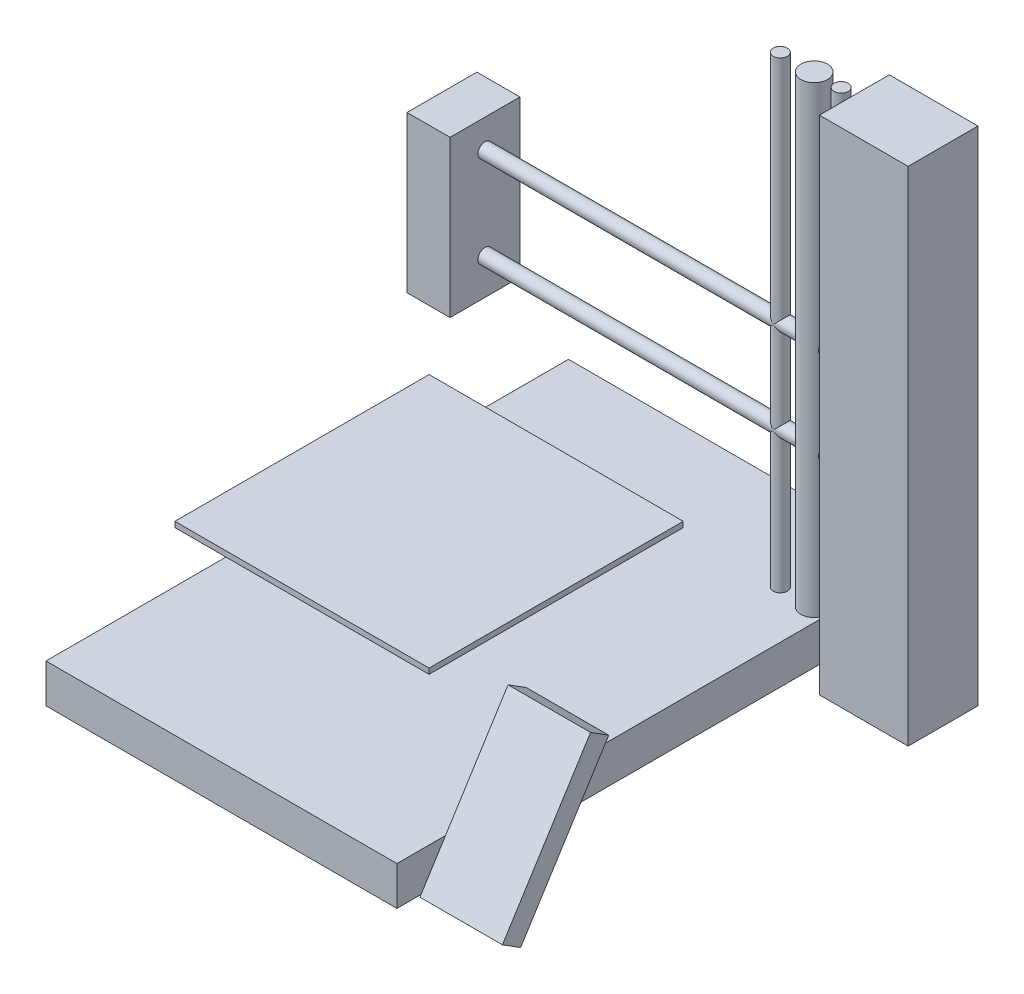
from build123d import *

# Parameters (mm, degrees)
BOSS_EXTRUDE2_DEPTH      = 185
BOSS_EXTRUDE2_DEPTH_BACK = 185
SKETCH4_W                = 248.533663501
SKETCH4_H                = 27.532163485
SKETCH5_W                = 180
SKETCH5_H                = 3.871635079
BOSS_EXTRUDE3_DEPTH      = 90
BOSS_EXTRUDE4_DEPTH      = 177.8
BOSS_EXTRUDE4_DEPTH_BACK = 177.8
SKETCH6_R                = 5.025331162
SKETCH6_R_2              = 9.441458003
SKETCH6_W                = 62.792760194
SKETCH6_H                = 49.48497721
SKETCH7_R                = 5.025331162
SKETCH7_R_2              = 5.072702707
BOSS_EXTRUDE5_DEPTH      = 292.1
SKETCH8_W                = 49.48497721
SKETCH8_H                = 110.589366722
BOSS_EXTRUDE6_DEPTH      = 30.48
BOSS_EXTRUDE7_DEPTH      = 63.5
SKETCH10_W               = 127.680202502
SKETCH10_H               = 144.797768112
CUT_EXTRUDE1_DEPTH       = 5.08


with BuildPart() as part:
    # Sketch4 → Boss-Extrude2 (new, two sides: drawn at the far end of the back side and taken through both)
    with BuildSketch(Plane.XY.offset(-BOSS_EXTRUDE2_DEPTH_BACK)):
        with Locations((-40.733168249, -164.033918258)):
            Rectangle(SKETCH4_W, SKETCH4_H)
    extrude(amount=BOSS_EXTRUDE2_DEPTH + BOSS_EXTRUDE2_DEPTH_BACK)

    # Sketch6 → Boss-Extrude4 (add, two sides: drawn at the far end of the back side and taken through both)
    with BuildSketch(Plane(origin=(0, 0, 0), x_dir=(1, 0, 0), z_dir=(0, 1, 0)).offset(-BOSS_EXTRUDE4_DEPTH_BACK)):
        with Locations(Location((92.850962378, 120.294813631, 0), (0, 0, 270))):
            Circle(SKETCH6_R)
        with Locations(Location((49.741152746, 120.294813631, 0), (0, 0, 270))):
            Circle(SKETCH6_R)
        with Locations(Location((73.714412737, 120.294813631, 0), (0, 0, 270))):
            Circle(SKETCH6_R_2)
        with Locations((133.603619903, 120.294813631)):
            Rectangle(SKETCH6_W, SKETCH6_H)
    extrude(amount=BOSS_EXTRUDE4_DEPTH + BOSS_EXTRUDE4_DEPTH_BACK)


with BuildPart() as body_2:
    # Sketch5 → Boss-Extrude3 (new, symmetric)
    with BuildSketch(Plane.XY):
        with Locations((-78.709697899, -115.907075187)):
            Rectangle(SKETCH5_W, SKETCH5_H)
    extrude(amount=BOSS_EXTRUDE3_DEPTH, both=True)


with BuildPart() as boss_extrude4_piece_1:
    # of the separate pieces the step leaves, piece 1, a body of its own (boss_extrude4_pieces)
    add(part.part.solids().sort_by_distance((-165, -150.267836515, 185))[0])



with BuildPart() as boss_extrude4_piece_2:
    # of the separate pieces the step leaves, piece 2, a body of its own (boss_extrude4_pieces)
    add(part.part.solids().sort_by_distance((165, 177.8, -145.037302236))[0])


with BuildPart() as boss_extrude4_piece_3:
    # of the separate pieces the step leaves, piece 3, a body of its own (boss_extrude4_pieces)
    add(part.part.solids().sort_by_distance((92.850962378, 0, -115.269482469))[0])


with BuildPart() as boss_extrude4_piece_1_1:
    add(boss_extrude4_piece_1.part)

    add(boss_extrude4_piece_2.part)  # Boss-Extrude5 merges Boss-Extrude4 piece 2

    add(boss_extrude4_piece_3.part)  # Boss-Extrude5 merges Boss-Extrude4 piece 3
    # Sketch7 → Boss-Extrude5 (add)
    with BuildSketch(Plane.ZY.offset(-102.207239806)):
        with Locations(Location((-120.294813631, 13.308745585, 0), (0, 0, 180))):
            Circle(SKETCH7_R)
        with Locations(Location((-120.294813631, -51.589208853, 0), (0, 0, 180))):
            Circle(SKETCH7_R_2)
    extrude(amount=BOSS_EXTRUDE5_DEPTH)

    # Sketch8 → Boss-Extrude6 (add)
    with BuildSketch(Plane.ZY.offset(189.892760194)):
        with Locations((-120.294813631, -21.884996612)):
            Rectangle(SKETCH8_W, SKETCH8_H)
    extrude(amount=-BOSS_EXTRUDE6_DEPTH)


with BuildPart() as body_3:
    # Sketch9 → Boss-Extrude7 (new body)
    with BuildSketch(Plane(origin=(88.9, 0, 0), x_dir=(0, 0, -1), z_dir=(1, 0, 0))):
        Polygon((-103.861334795, -77.657367924), (-166.284847112, -176.717367924), (-179.17835943, -168.592410071), (-116.754847112, -69.532410071), align=None)
    extrude(amount=BOSS_EXTRUDE7_DEPTH)

    # Sketch10 → Cut-Extrude1 (cut)
    with BuildSketch(Plane.ZY.offset(-88.9)):
        with Locations((163.77033748, -106.804637192)):
            Rectangle(SKETCH10_W, SKETCH10_H)
    extrude(amount=-CUT_EXTRUDE1_DEPTH, mode=Mode.SUBTRACT)


solid = Compound([body_2.part, boss_extrude4_piece_1_1.part, body_3.part])
